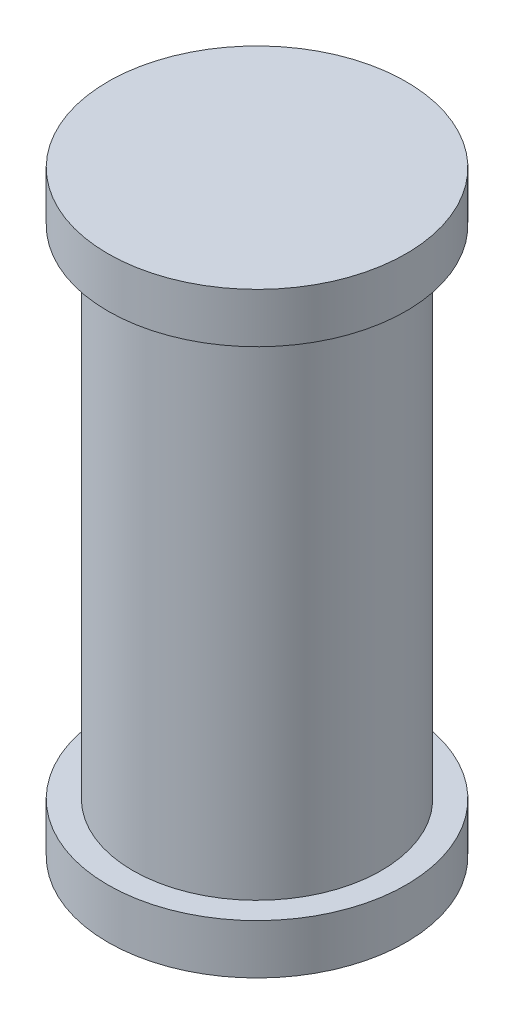
from build123d import *

# Parameters (mm, degrees)
SKETCH_1_R      = 30
EXTRUDE_1_DEPTH = 10
SKETCH_2_R      = 25
EXTRUDE_2_DEPTH = 100
SKETCH_3_R      = 30
EXTRUDE_3_DEPTH = 10


with BuildPart() as part:
    # 草圖1 → 填料-伸長1 (new body)
    with BuildSketch(Plane(origin=(0, 0, 0), x_dir=(1, 0, 0), z_dir=(0, 1, 0))):
        with Locations(Location((0, 0, 0), (0, 0, 270))):
            Circle(SKETCH_1_R)
    extrude(amount=EXTRUDE_1_DEPTH)

    # 草圖2 → 填料-伸長2 (add)
    with BuildSketch(Plane(origin=(0, 10, 0), x_dir=(1, 0, 0), z_dir=(0, 1, 0))):
        with Locations(Location((0, 0, 0), (0, 0, 270))):
            Circle(SKETCH_2_R)
    extrude(amount=EXTRUDE_2_DEPTH)

    # 草圖3 → 填料-伸長3 (add)
    with BuildSketch(Plane(origin=(0, 110, 0), x_dir=(1, 0, 0), z_dir=(0, 1, 0))):
        with Locations(Location((0, 0, 0), (0, 0, 270))):
            Circle(SKETCH_3_R)
    extrude(amount=EXTRUDE_3_DEPTH)


solid = part.part
